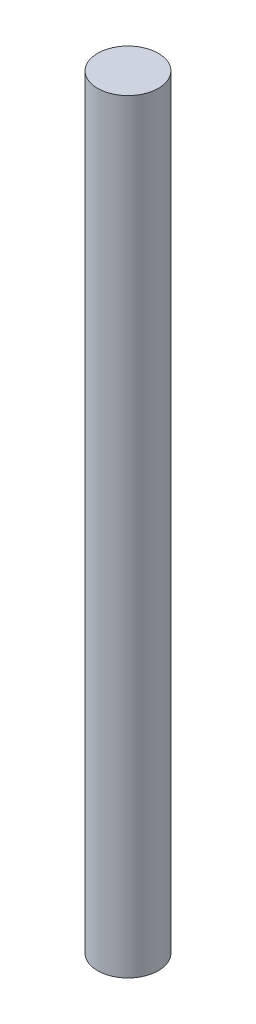
from build123d import *

# Parameters (mm, degrees)
SKETCH1_R           = 3.975
BOSS_EXTRUDE1_DEPTH = 100


with BuildPart() as part:
    # Sketch1 → Boss-Extrude1 (new body)
    with BuildSketch(Plane(origin=(0, 0, 0), x_dir=(1, 0, 0), z_dir=(0, 1, 0))):
        with Locations(Location((0, 0, 0), (0, 0, 270))):
            Circle(SKETCH1_R)
    extrude(amount=BOSS_EXTRUDE1_DEPTH)


solid = part.part
